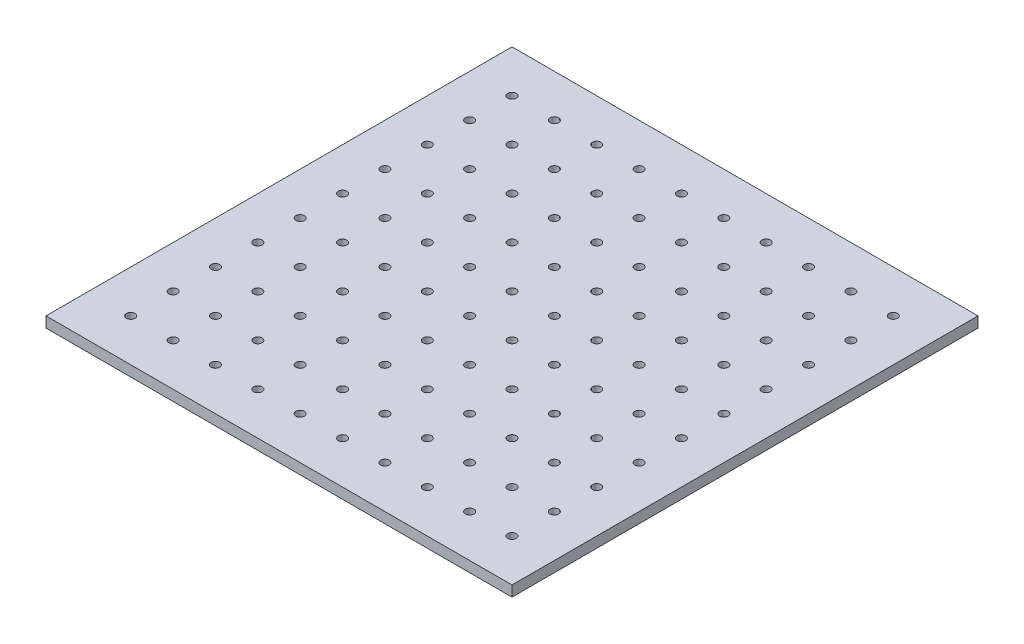
from build123d import *

# Parameters (mm, degrees)
SKETCH1_W           = 279.4
SKETCH1_H           = 279.4
SKETCH1_R           = 2.5527
BOSS_EXTRUDE1_DEPTH = 6.35


with BuildPart() as part:
    # Sketch1 → Boss-Extrude1 (new body)
    with BuildSketch(Plane(origin=(0, 0, 0), x_dir=(1, 0, 0), z_dir=(0, 1, 0))):
        with Locations((114.3, 114.3)):
            Rectangle(SKETCH1_W, SKETCH1_H)
        with Locations(Location((0, 0, 0), (0, 0, 270))):
            Circle(SKETCH1_R, mode=Mode.SUBTRACT)
        with Locations(Location((25.4, 0, 0), (0, 0, 270))):
            Circle(SKETCH1_R, mode=Mode.SUBTRACT)
        with Locations(Location((50.8, 0, 0), (0, 0, 270))):
            Circle(SKETCH1_R, mode=Mode.SUBTRACT)
        with Locations(Location((76.2, 0, 0), (0, 0, 270))):
            Circle(SKETCH1_R, mode=Mode.SUBTRACT)
        with Locations(Location((101.6, 0, 0), (0, 0, 270))):
            Circle(SKETCH1_R, mode=Mode.SUBTRACT)
        with Locations(Location((127, 0, 0), (0, 0, 270))):
            Circle(SKETCH1_R, mode=Mode.SUBTRACT)
        with Locations(Location((152.4, 0, 0), (0, 0, 270))):
            Circle(SKETCH1_R, mode=Mode.SUBTRACT)
        with Locations(Location((177.8, 0, 0), (0, 0, 270))):
            Circle(SKETCH1_R, mode=Mode.SUBTRACT)
        with Locations(Location((203.2, 0, 0), (0, 0, 270))):
            Circle(SKETCH1_R, mode=Mode.SUBTRACT)
        with Locations(Location((228.6, 0, 0), (0, 0, 270))):
            Circle(SKETCH1_R, mode=Mode.SUBTRACT)
        with Locations(Location((0, 25.4, 0), (0, 0, 270))):
            Circle(SKETCH1_R, mode=Mode.SUBTRACT)
        with Locations(Location((25.4, 25.4, 0), (0, 0, 270))):
            Circle(SKETCH1_R, mode=Mode.SUBTRACT)
        with Locations(Location((50.8, 25.4, 0), (0, 0, 270))):
            Circle(SKETCH1_R, mode=Mode.SUBTRACT)
        with Locations(Location((76.2, 25.4, 0), (0, 0, 270))):
            Circle(SKETCH1_R, mode=Mode.SUBTRACT)
        with Locations(Location((101.6, 25.4, 0), (0, 0, 270))):
            Circle(SKETCH1_R, mode=Mode.SUBTRACT)
        with Locations(Location((127, 25.4, 0), (0, 0, 270))):
            Circle(SKETCH1_R, mode=Mode.SUBTRACT)
        with Locations(Location((152.4, 25.4, 0), (0, 0, 270))):
            Circle(SKETCH1_R, mode=Mode.SUBTRACT)
        with Locations(Location((177.8, 25.4, 0), (0, 0, 270))):
            Circle(SKETCH1_R, mode=Mode.SUBTRACT)
        with Locations(Location((203.2, 25.4, 0), (0, 0, 270))):
            Circle(SKETCH1_R, mode=Mode.SUBTRACT)
        with Locations(Location((228.6, 25.4, 0), (0, 0, 270))):
            Circle(SKETCH1_R, mode=Mode.SUBTRACT)
        with Locations(Location((0, 50.8, 0), (0, 0, 270))):
            Circle(SKETCH1_R, mode=Mode.SUBTRACT)
        with Locations(Location((25.4, 50.8, 0), (0, 0, 270))):
            Circle(SKETCH1_R, mode=Mode.SUBTRACT)
        with Locations(Location((50.8, 50.8, 0), (0, 0, 270))):
            Circle(SKETCH1_R, mode=Mode.SUBTRACT)
        with Locations(Location((76.2, 50.8, 0), (0, 0, 270))):
            Circle(SKETCH1_R, mode=Mode.SUBTRACT)
        with Locations(Location((101.6, 50.8, 0), (0, 0, 270))):
            Circle(SKETCH1_R, mode=Mode.SUBTRACT)
        with Locations(Location((127, 50.8, 0), (0, 0, 270))):
            Circle(SKETCH1_R, mode=Mode.SUBTRACT)
        with Locations(Location((152.4, 50.8, 0), (0, 0, 270))):
            Circle(SKETCH1_R, mode=Mode.SUBTRACT)
        with Locations(Location((177.8, 50.8, 0), (0, 0, 270))):
            Circle(SKETCH1_R, mode=Mode.SUBTRACT)
        with Locations(Location((203.2, 50.8, 0), (0, 0, 270))):
            Circle(SKETCH1_R, mode=Mode.SUBTRACT)
        with Locations(Location((228.6, 50.8, 0), (0, 0, 270))):
            Circle(SKETCH1_R, mode=Mode.SUBTRACT)
        with Locations(Location((0, 76.2, 0), (0, 0, 270))):
            Circle(SKETCH1_R, mode=Mode.SUBTRACT)
        with Locations(Location((25.4, 76.2, 0), (0, 0, 270))):
            Circle(SKETCH1_R, mode=Mode.SUBTRACT)
        with Locations(Location((50.8, 76.2, 0), (0, 0, 270))):
            Circle(SKETCH1_R, mode=Mode.SUBTRACT)
        with Locations(Location((76.2, 76.2, 0), (0, 0, 270))):
            Circle(SKETCH1_R, mode=Mode.SUBTRACT)
        with Locations(Location((101.6, 76.2, 0), (0, 0, 270))):
            Circle(SKETCH1_R, mode=Mode.SUBTRACT)
        with Locations(Location((127, 76.2, 0), (0, 0, 270))):
            Circle(SKETCH1_R, mode=Mode.SUBTRACT)
        with Locations(Location((152.4, 76.2, 0), (0, 0, 270))):
            Circle(SKETCH1_R, mode=Mode.SUBTRACT)
        with Locations(Location((177.8, 76.2, 0), (0, 0, 270))):
            Circle(SKETCH1_R, mode=Mode.SUBTRACT)
        with Locations(Location((203.2, 76.2, 0), (0, 0, 270))):
            Circle(SKETCH1_R, mode=Mode.SUBTRACT)
        with Locations(Location((228.6, 76.2, 0), (0, 0, 270))):
            Circle(SKETCH1_R, mode=Mode.SUBTRACT)
        with Locations(Location((0, 101.6, 0), (0, 0, 270))):
            Circle(SKETCH1_R, mode=Mode.SUBTRACT)
        with Locations(Location((25.4, 101.6, 0), (0, 0, 270))):
            Circle(SKETCH1_R, mode=Mode.SUBTRACT)
        with Locations(Location((50.8, 101.6, 0), (0, 0, 270))):
            Circle(SKETCH1_R, mode=Mode.SUBTRACT)
        with Locations(Location((76.2, 101.6, 0), (0, 0, 270))):
            Circle(SKETCH1_R, mode=Mode.SUBTRACT)
        with Locations(Location((101.6, 101.6, 0), (0, 0, 270))):
            Circle(SKETCH1_R, mode=Mode.SUBTRACT)
        with Locations(Location((127, 101.6, 0), (0, 0, 270))):
            Circle(SKETCH1_R, mode=Mode.SUBTRACT)
        with Locations(Location((152.4, 101.6, 0), (0, 0, 270))):
            Circle(SKETCH1_R, mode=Mode.SUBTRACT)
        with Locations(Location((177.8, 101.6, 0), (0, 0, 270))):
            Circle(SKETCH1_R, mode=Mode.SUBTRACT)
        with Locations(Location((203.2, 101.6, 0), (0, 0, 270))):
            Circle(SKETCH1_R, mode=Mode.SUBTRACT)
        with Locations(Location((228.6, 101.6, 0), (0, 0, 270))):
            Circle(SKETCH1_R, mode=Mode.SUBTRACT)
        with Locations(Location((0, 127, 0), (0, 0, 270))):
            Circle(SKETCH1_R, mode=Mode.SUBTRACT)
        with Locations(Location((25.4, 127, 0), (0, 0, 270))):
            Circle(SKETCH1_R, mode=Mode.SUBTRACT)
        with Locations(Location((50.8, 127, 0), (0, 0, 270))):
            Circle(SKETCH1_R, mode=Mode.SUBTRACT)
        with Locations(Location((76.2, 127, 0), (0, 0, 270))):
            Circle(SKETCH1_R, mode=Mode.SUBTRACT)
        with Locations(Location((101.6, 127, 0), (0, 0, 270))):
            Circle(SKETCH1_R, mode=Mode.SUBTRACT)
        with Locations(Location((127, 127, 0), (0, 0, 270))):
            Circle(SKETCH1_R, mode=Mode.SUBTRACT)
        with Locations(Location((152.4, 127, 0), (0, 0, 270))):
            Circle(SKETCH1_R, mode=Mode.SUBTRACT)
        with Locations(Location((177.8, 127, 0), (0, 0, 270))):
            Circle(SKETCH1_R, mode=Mode.SUBTRACT)
        with Locations(Location((203.2, 127, 0), (0, 0, 270))):
            Circle(SKETCH1_R, mode=Mode.SUBTRACT)
        with Locations(Location((228.6, 127, 0), (0, 0, 270))):
            Circle(SKETCH1_R, mode=Mode.SUBTRACT)
        with Locations(Location((0, 152.4, 0), (0, 0, 270))):
            Circle(SKETCH1_R, mode=Mode.SUBTRACT)
        with Locations(Location((25.4, 152.4, 0), (0, 0, 270))):
            Circle(SKETCH1_R, mode=Mode.SUBTRACT)
        with Locations(Location((50.8, 152.4, 0), (0, 0, 270))):
            Circle(SKETCH1_R, mode=Mode.SUBTRACT)
        with Locations(Location((76.2, 152.4, 0), (0, 0, 270))):
            Circle(SKETCH1_R, mode=Mode.SUBTRACT)
        with Locations(Location((101.6, 152.4, 0), (0, 0, 270))):
            Circle(SKETCH1_R, mode=Mode.SUBTRACT)
        with Locations(Location((127, 152.4, 0), (0, 0, 270))):
            Circle(SKETCH1_R, mode=Mode.SUBTRACT)
        with Locations(Location((152.4, 152.4, 0), (0, 0, 270))):
            Circle(SKETCH1_R, mode=Mode.SUBTRACT)
        with Locations(Location((177.8, 152.4, 0), (0, 0, 270))):
            Circle(SKETCH1_R, mode=Mode.SUBTRACT)
        with Locations(Location((203.2, 152.4, 0), (0, 0, 270))):
            Circle(SKETCH1_R, mode=Mode.SUBTRACT)
        with Locations(Location((228.6, 152.4, 0), (0, 0, 270))):
            Circle(SKETCH1_R, mode=Mode.SUBTRACT)
        with Locations(Location((0, 177.8, 0), (0, 0, 270))):
            Circle(SKETCH1_R, mode=Mode.SUBTRACT)
        with Locations(Location((25.4, 177.8, 0), (0, 0, 270))):
            Circle(SKETCH1_R, mode=Mode.SUBTRACT)
        with Locations(Location((50.8, 177.8, 0), (0, 0, 270))):
            Circle(SKETCH1_R, mode=Mode.SUBTRACT)
        with Locations(Location((76.2, 177.8, 0), (0, 0, 270))):
            Circle(SKETCH1_R, mode=Mode.SUBTRACT)
        with Locations(Location((101.6, 177.8, 0), (0, 0, 270))):
            Circle(SKETCH1_R, mode=Mode.SUBTRACT)
        with Locations(Location((127, 177.8, 0), (0, 0, 270))):
            Circle(SKETCH1_R, mode=Mode.SUBTRACT)
        with Locations(Location((152.4, 177.8, 0), (0, 0, 270))):
            Circle(SKETCH1_R, mode=Mode.SUBTRACT)
        with Locations(Location((177.8, 177.8, 0), (0, 0, 270))):
            Circle(SKETCH1_R, mode=Mode.SUBTRACT)
        with Locations(Location((203.2, 177.8, 0), (0, 0, 270))):
            Circle(SKETCH1_R, mode=Mode.SUBTRACT)
        with Locations(Location((228.6, 177.8, 0), (0, 0, 270))):
            Circle(SKETCH1_R, mode=Mode.SUBTRACT)
        with Locations(Location((0, 203.2, 0), (0, 0, 270))):
            Circle(SKETCH1_R, mode=Mode.SUBTRACT)
        with Locations(Location((25.4, 203.2, 0), (0, 0, 270))):
            Circle(SKETCH1_R, mode=Mode.SUBTRACT)
        with Locations(Location((50.8, 203.2, 0), (0, 0, 270))):
            Circle(SKETCH1_R, mode=Mode.SUBTRACT)
        with Locations(Location((76.2, 203.2, 0), (0, 0, 270))):
            Circle(SKETCH1_R, mode=Mode.SUBTRACT)
        with Locations(Location((101.6, 203.2, 0), (0, 0, 270))):
            Circle(SKETCH1_R, mode=Mode.SUBTRACT)
        with Locations(Location((127, 203.2, 0), (0, 0, 270))):
            Circle(SKETCH1_R, mode=Mode.SUBTRACT)
        with Locations(Location((152.4, 203.2, 0), (0, 0, 270))):
            Circle(SKETCH1_R, mode=Mode.SUBTRACT)
        with Locations(Location((177.8, 203.2, 0), (0, 0, 270))):
            Circle(SKETCH1_R, mode=Mode.SUBTRACT)
        with Locations(Location((203.2, 203.2, 0), (0, 0, 270))):
            Circle(SKETCH1_R, mode=Mode.SUBTRACT)
        with Locations(Location((228.6, 203.2, 0), (0, 0, 270))):
            Circle(SKETCH1_R, mode=Mode.SUBTRACT)
        with Locations(Location((0, 228.6, 0), (0, 0, 270))):
            Circle(SKETCH1_R, mode=Mode.SUBTRACT)
        with Locations(Location((25.4, 228.6, 0), (0, 0, 270))):
            Circle(SKETCH1_R, mode=Mode.SUBTRACT)
        with Locations(Location((50.8, 228.6, 0), (0, 0, 270))):
            Circle(SKETCH1_R, mode=Mode.SUBTRACT)
        with Locations(Location((76.2, 228.6, 0), (0, 0, 270))):
            Circle(SKETCH1_R, mode=Mode.SUBTRACT)
        with Locations(Location((101.6, 228.6, 0), (0, 0, 270))):
            Circle(SKETCH1_R, mode=Mode.SUBTRACT)
        with Locations(Location((127, 228.6, 0), (0, 0, 270))):
            Circle(SKETCH1_R, mode=Mode.SUBTRACT)
        with Locations(Location((152.4, 228.6, 0), (0, 0, 270))):
            Circle(SKETCH1_R, mode=Mode.SUBTRACT)
        with Locations(Location((177.8, 228.6, 0), (0, 0, 270))):
            Circle(SKETCH1_R, mode=Mode.SUBTRACT)
        with Locations(Location((203.2, 228.6, 0), (0, 0, 270))):
            Circle(SKETCH1_R, mode=Mode.SUBTRACT)
        with Locations(Location((228.6, 228.6, 0), (0, 0, 270))):
            Circle(SKETCH1_R, mode=Mode.SUBTRACT)
    extrude(amount=BOSS_EXTRUDE1_DEPTH)


solid = part.part
